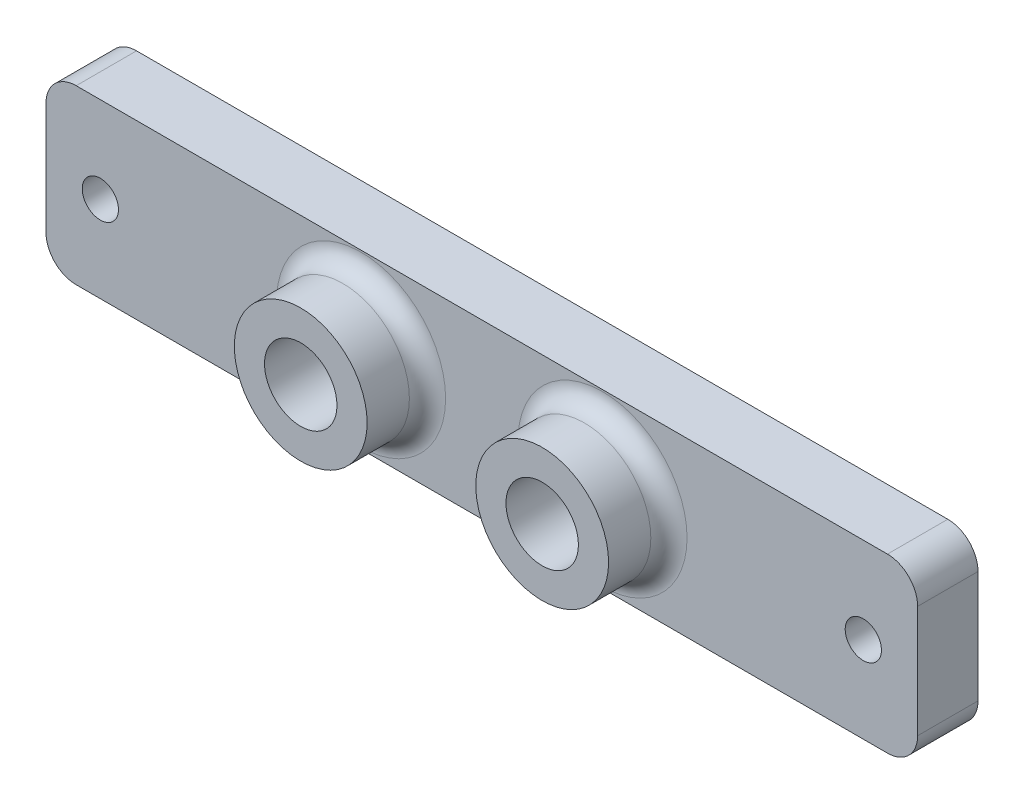
from build123d import *

# Parameters (mm, degrees)
SKETCH_1_W      = 72.2
SKETCH_1_H      = 14.28
SKETCH_1_R      = 1.5
SKETCH_1_R_2    = 3
EXTRUDE_1_DEPTH = 5
FILLET_1_R      = 2.5
SKETCH_2_R      = 5.5
SKETCH_2_R_2    = 3
EXTRUDE_2_DEPTH = 5
FILLET_2_R      = 1.5


with BuildPart() as part:
    # 草图1 → 凸台-拉伸1 (new body)
    with BuildSketch(Plane.XY):
        Rectangle(SKETCH_1_W, SKETCH_1_H)
        with Locations((31.6, 0)):
            Circle(SKETCH_1_R, mode=Mode.SUBTRACT)
        with Locations((-31.6, 0)):
            Circle(SKETCH_1_R, mode=Mode.SUBTRACT)
        with Locations((10, 0)):
            Circle(SKETCH_1_R_2, mode=Mode.SUBTRACT)
        with Locations((-10, 0)):
            Circle(SKETCH_1_R_2, mode=Mode.SUBTRACT)
    extrude(amount=EXTRUDE_1_DEPTH)

    # 圆角1
    fillet_1_edges = [part.edges().sort_by_distance(p)[0] for p in [
        (-36.1, 7.14, 2.5),
        (36.1, 7.14, 2.5),
        (36.1, -7.14, 2.5),
        (-36.1, -7.14, 2.5),
    ]]
    fillet(fillet_1_edges, radius=FILLET_1_R)

    # 草图2 → 凸台-拉伸2 (add)
    # profile 1 of 2: a face of its own
    with BuildSketch(Plane.XY.offset(5)):
        with Locations((-10, 0)):
            Circle(SKETCH_2_R)
        with Locations((-10, 0)):
            Circle(SKETCH_2_R_2, mode=Mode.SUBTRACT)
    # profile 2 of 2: a face of its own
    with BuildSketch(Plane.XY.offset(5)):
        with Locations((10, 0)):
            Circle(SKETCH_2_R)
        with Locations((10, 0)):
            Circle(SKETCH_2_R_2, mode=Mode.SUBTRACT)
    extrude(amount=EXTRUDE_2_DEPTH)

    # 圆角2
    fillet_2_edges = [part.edges().sort_by_distance(p)[0] for p in [
        (-15.5, 0, 5),
        (4.5, 0, 5),
    ]]
    fillet(fillet_2_edges, radius=FILLET_2_R)


solid = part.part
